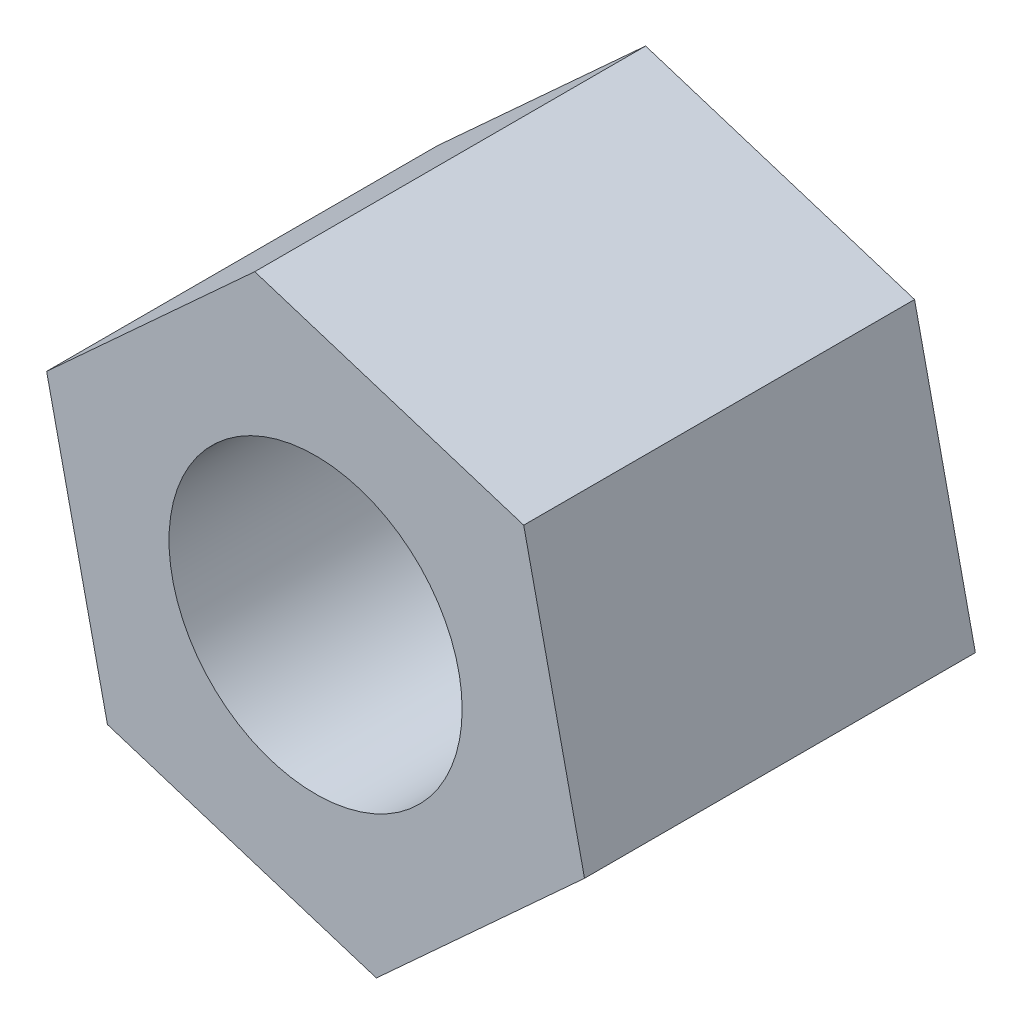
from build123d import *

# Parameters (mm, degrees)
SKETCH_1_R      = 1.5
EXTRUDE_1_DEPTH = 4


with BuildPart() as part:
    # 草图1 → 凸台-拉伸1 (new body)
    with BuildSketch(Plane.XY):
        Polygon((-0.622347486, 2.818868025), (-2.752385062, 0.870465279), (-2.130037576, -1.948402745), (0.622347486, -2.818868025), (2.752385062, -0.870465279), (2.130037576, 1.948402745), align=None)
        Circle(SKETCH_1_R, mode=Mode.SUBTRACT)
    extrude(amount=EXTRUDE_1_DEPTH)


solid = part.part
